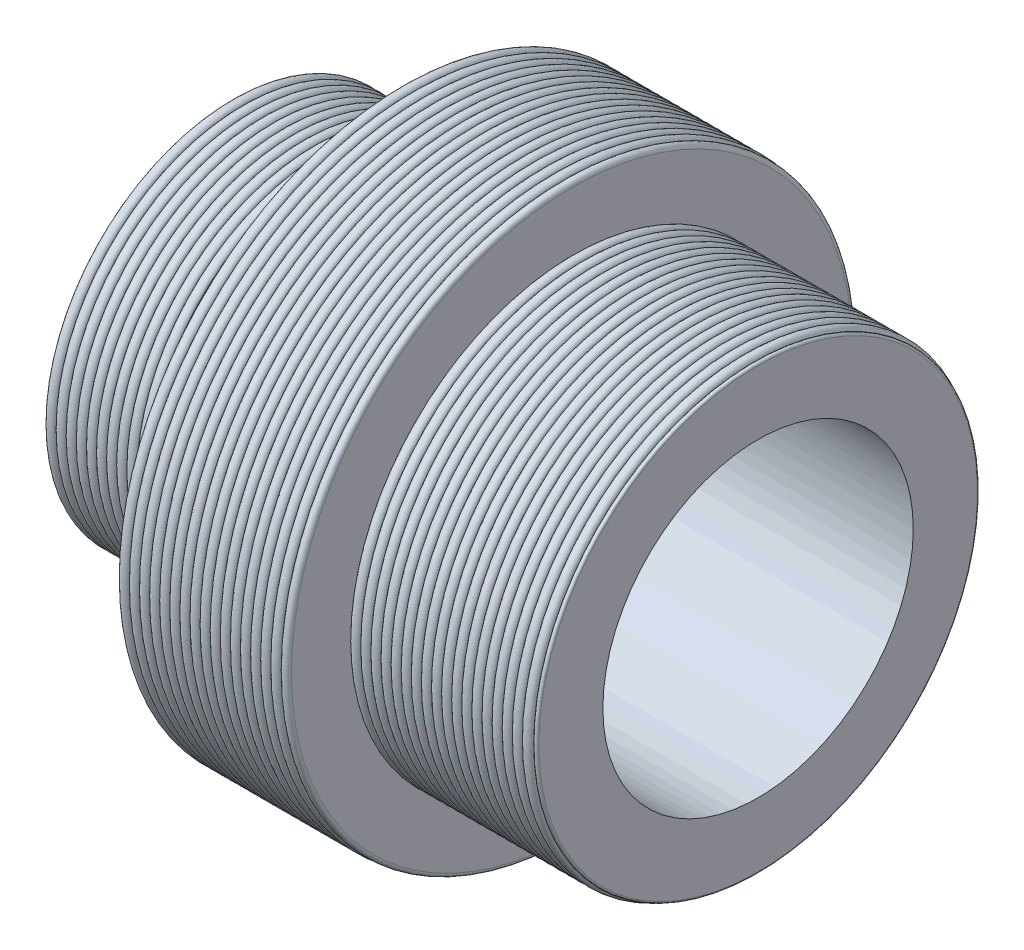
from build123d import *


with BuildPart() as part:
    # Croquis1 → Revolución1 (revolve)
    with BuildSketch(Plane.XY, mode=Mode.PRIVATE) as revoluci_n1_sk:
        with BuildLine():
            Line((-51, 29.195), (-19, 29.195))
            Line((-19, 29.195), (-19, 34.565))
            ThreePointArc((-19, 34.565), (-19.8, 35.365), (-20.6, 34.565))
            ThreePointArc((-20.6, 34.565), (-21.55, 35.515), (-22.5, 34.565))
            ThreePointArc((-22.5, 34.565), (-23.45, 35.515), (-24.4, 34.565))
            ThreePointArc((-24.4, 34.565), (-25.35, 35.515), (-26.3, 34.565))
            ThreePointArc((-26.3, 34.565), (-27.25, 35.515), (-28.2, 34.565))
            ThreePointArc((-28.2, 34.565), (-29.15, 35.515), (-30.1, 34.565))
            ThreePointArc((-30.1, 34.565), (-31.05, 35.515), (-32, 34.565))
            ThreePointArc((-32, 34.565), (-32.95, 35.515), (-33.9, 34.565))
            ThreePointArc((-33.9, 34.565), (-34.85, 35.515), (-35.8, 34.565))
            ThreePointArc((-35.8, 34.565), (-36.75, 35.515), (-37.7, 34.565))
            ThreePointArc((-37.7, 34.565), (-38.65, 35.515), (-39.6, 34.565))
            ThreePointArc((-39.6, 34.565), (-40.55, 35.515), (-41.5, 34.565))
            ThreePointArc((-41.5, 34.565), (-42.45, 35.515), (-43.4, 34.565))
            ThreePointArc((-43.4, 34.565), (-44.35, 35.515), (-45.3, 34.565))
            ThreePointArc((-45.3, 34.565), (-46.25, 35.515), (-47.2, 34.565))
            ThreePointArc((-47.2, 34.565), (-48.15, 35.515), (-49.1, 34.565))
            ThreePointArc((-49.1, 34.565), (-50.05, 35.515), (-51, 34.565))
            Line((-51, 34.565), (-51, 29.195))
        make_face()
        with BuildLine():
            ThreePointArc((11.4, 52.78), (12.2, 53.58), (13, 52.78))
            Line((13, 52.78), (13, 29.195))
            Line((13, 29.195), (-19, 29.195))
            Line((-19, 29.195), (-19, 52.78))
            ThreePointArc((-19, 52.78), (-18.05, 53.73), (-17.1, 52.78))
            ThreePointArc((-17.1, 52.78), (-16.15, 53.73), (-15.2, 52.78))
            ThreePointArc((-15.2, 52.78), (-14.25, 53.73), (-13.3, 52.78))
            ThreePointArc((-13.3, 52.78), (-12.35, 53.73), (-11.4, 52.78))
            ThreePointArc((-11.4, 52.78), (-10.45, 53.73), (-9.5, 52.78))
            ThreePointArc((-9.5, 52.78), (-8.55, 53.73), (-7.6, 52.78))
            ThreePointArc((-7.6, 52.78), (-6.65, 53.73), (-5.7, 52.78))
            ThreePointArc((-5.7, 52.78), (-4.75, 53.73), (-3.8, 52.78))
            ThreePointArc((-3.8, 52.78), (-2.85, 53.73), (-1.9, 52.78))
            ThreePointArc((-1.9, 52.78), (-0.95, 53.73), (0, 52.78))
            ThreePointArc((0, 52.78), (0.95, 53.73), (1.9, 52.78))
            ThreePointArc((1.9, 52.78), (2.85, 53.73), (3.8, 52.78))
            ThreePointArc((3.8, 52.78), (4.75, 53.73), (5.7, 52.78))
            ThreePointArc((5.7, 52.78), (6.65, 53.73), (7.6, 52.78))
            ThreePointArc((7.6, 52.78), (8.55, 53.73), (9.5, 52.78))
            ThreePointArc((9.5, 52.78), (10.45, 53.73), (11.4, 52.78))
        make_face()
        with BuildLine():
            Line((13, 29.195), (48, 29.195))
            Line((48, 29.195), (48, 41.245))
            ThreePointArc((48, 41.245), (47.6, 41.645), (47.2, 41.245))
            ThreePointArc((47.2, 41.245), (46.25, 42.195), (45.3, 41.245))
            ThreePointArc((45.3, 41.245), (44.35, 42.195), (43.4, 41.245))
            ThreePointArc((43.4, 41.245), (42.45, 42.195), (41.5, 41.245))
            ThreePointArc((41.5, 41.245), (40.55, 42.195), (39.6, 41.245))
            ThreePointArc((39.6, 41.245), (38.65, 42.195), (37.7, 41.245))
            ThreePointArc((37.7, 41.245), (36.75, 42.195), (35.8, 41.245))
            ThreePointArc((35.8, 41.245), (34.85, 42.195), (33.9, 41.245))
            ThreePointArc((33.9, 41.245), (32.95, 42.195), (32, 41.245))
            ThreePointArc((32, 41.245), (31.05, 42.195), (30.1, 41.245))
            ThreePointArc((30.1, 41.245), (29.15, 42.195), (28.2, 41.245))
            ThreePointArc((28.2, 41.245), (27.25, 42.195), (26.3, 41.245))
            ThreePointArc((26.3, 41.245), (25.35, 42.195), (24.4, 41.245))
            ThreePointArc((24.4, 41.245), (23.45, 42.195), (22.5, 41.245))
            ThreePointArc((22.5, 41.245), (21.55, 42.195), (20.6, 41.245))
            ThreePointArc((20.6, 41.245), (19.65, 42.195), (18.7, 41.245))
            ThreePointArc((18.7, 41.245), (17.75, 42.195), (16.8, 41.245))
            ThreePointArc((16.8, 41.245), (15.85, 42.195), (14.9, 41.245))
            ThreePointArc((14.9, 41.245), (13.95, 42.195), (13, 41.245))
            Line((13, 41.245), (13, 29.195))
        make_face()
    revolve(revoluci_n1_sk.sketch.rotate(Axis((-55, 0, 0), (1, 0, 0)), 90), axis=Axis((-55, 0, 0), (1, 0, 0)))


solid = part.part
